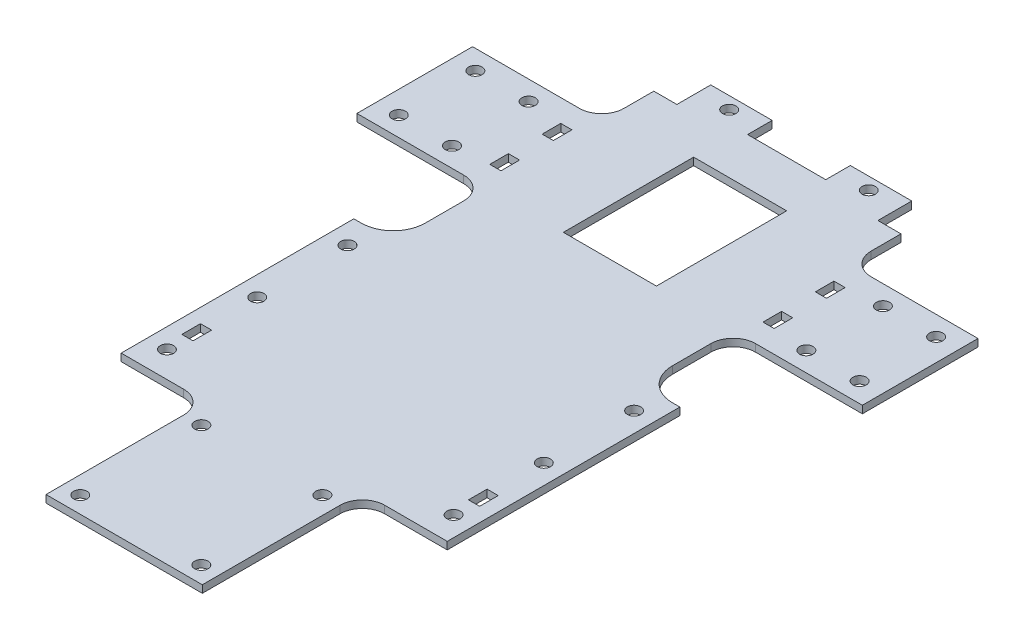
from build123d import *

# Parameters (mm, degrees)
SKETCH1_W            = 50
SKETCH1_H            = 9.1
BOSS_EXTRUDE1_DEPTH  = 2
SKETCH2_W            = 25
SKETCH2_H            = 6.6
CUT_EXTRUDE1_DEPTH   = 2
SKETCH3_R            = 1.8
CUT_EXTRUDE2_DEPTH   = 2
SKETCH4_W            = 66.4
SKETCH4_H            = 130
BOSS_EXTRUDE2_DEPTH  = 2
SKETCH5_W            = 66.4
SKETCH5_H            = 2
BOSS_EXTRUDE3_DEPTH  = 2.5
SKETCH6_W            = 8.6
SKETCH6_H            = 62.5
BOSS_EXTRUDE4_DEPTH  = 2
SKETCH7_R            = 1.8
SKETCH7_W            = 3
SKETCH7_H            = 5
CUT_EXTRUDE3_DEPTH   = 2
SKETCH8_W            = 25
SKETCH8_H            = 45
CUT_EXTRUDE4_DEPTH   = 20
SKETCH9_W            = 25
SKETCH9_H            = 10
BOSS_EXTRUDE5_DEPTH  = 2
SKETCH10_W           = 34.7
SKETCH10_H           = 27.07
BOSS_EXTRUDE6_DEPTH  = 2
SKETCH11_R           = 1.8
CUT_EXTRUDE5_DEPTH   = 2
SKETCH12_R           = 1.8
CUT_EXTRUDE6_DEPTH   = 2
SKETCH13_W           = 2
SKETCH13_H           = 2
BOSS_EXTRUDE7_DEPTH  = 44
SKETCH14_W           = 2
SKETCH14_H           = 2
BOSS_EXTRUDE8_DEPTH  = 46
BOSS_EXTRUDE9_DEPTH  = 2
SKETCH16_W           = 42
SKETCH16_H           = 43
BOSS_EXTRUDE10_DEPTH = 2
SKETCH18_R           = 1.8
CUT_EXTRUDE7_DEPTH   = 2
BOSS_EXTRUDE11_DEPTH = 2
BOSS_EXTRUDE12_DEPTH = 2
SKETCH21_W           = 2
SKETCH21_H           = 2
BOSS_EXTRUDE13_DEPTH = 10
SKETCH22_W           = 62.5
SKETCH22_H           = 2
BOSS_EXTRUDE14_DEPTH = 2
SKETCH23_W           = 62.5
SKETCH23_H           = 2
BOSS_EXTRUDE15_DEPTH = 2
SKETCH25_W           = 3
SKETCH25_H           = 5
CUT_EXTRUDE8_DEPTH   = 10


with BuildPart() as part:
    # Sketch1 → Boss-Extrude1 (new body)
    with BuildSketch(Plane(origin=(0, 0, 0), x_dir=(1, 0, 0), z_dir=(0, 1, 0))):
        with Locations((25, 4.55)):
            Rectangle(SKETCH1_W, SKETCH1_H)
    extrude(amount=BOSS_EXTRUDE1_DEPTH)

    # Sketch2 → Cut-Extrude1 (cut)
    with BuildSketch(Plane(origin=(0, 2, 0), x_dir=(1, 0, 0), z_dir=(0, 1, 0))):
        with Locations((25, 5.8)):
            Rectangle(SKETCH2_W, SKETCH2_H)
    extrude(amount=-CUT_EXTRUDE1_DEPTH, mode=Mode.SUBTRACT)

    # Sketch3 → Cut-Extrude2 (cut)
    with BuildSketch(Plane(origin=(0, 2, 0), x_dir=(1, 0, 0), z_dir=(0, 1, 0))):
        with Locations(Location((6.25, 5.8, 0), (0, 0, 270))):
            Circle(SKETCH3_R)
        with Locations(Location((43.75, 5.8, 0), (0, 0, 270))):
            Circle(SKETCH3_R)
    extrude(amount=-CUT_EXTRUDE2_DEPTH, mode=Mode.SUBTRACT)

    # Sketch4 → Boss-Extrude2 (add)
    with BuildSketch(Plane(origin=(0, 2, 0), x_dir=(1, 0, 0), z_dir=(0, 1, 0))):
        with Locations((25, -65)):
            Rectangle(SKETCH4_W, SKETCH4_H)
    extrude(amount=-BOSS_EXTRUDE2_DEPTH)

    # Sketch5 → Boss-Extrude3 (add)
    with BuildSketch(Plane.XY.offset(130)):
        with Locations((25, 1)):
            Rectangle(SKETCH5_W, SKETCH5_H)
    extrude(amount=BOSS_EXTRUDE3_DEPTH)

    # Sketch6 → Boss-Extrude4 (add)
    with BuildSketch(Plane(origin=(0, 2, 0), x_dir=(1, 0, 0), z_dir=(0, 1, 0))):
        with Locations((-12.5, -101.25)):
            Rectangle(SKETCH6_W, SKETCH6_H)
        with Locations((62.5, -101.25)):
            Rectangle(SKETCH6_W, SKETCH6_H)
    extrude(amount=-BOSS_EXTRUDE4_DEPTH)

    # Sketch7 → Cut-Extrude3 (cut)
    with BuildSketch(Plane(origin=(0, 2, 0), x_dir=(1, 0, 0), z_dir=(0, 1, 0))):
        with Locations(Location((-13.5, -77, 0), (0, 0, 270))):
            Circle(SKETCH7_R)
        with Locations(Location((-13.5, -101.25, 0), (0, 0, 270))):
            Circle(SKETCH7_R)
        with Locations(Location((-13.5, -125.5, 0), (0, 0, 270))):
            Circle(SKETCH7_R)
        with Locations(Location((63.5, -77, 0), (0, 0, 270))):
            Circle(SKETCH7_R)
        with Locations(Location((63.5, -101.25, 0), (0, 0, 270))):
            Circle(SKETCH7_R)
        with Locations(Location((63.5, -125.5, 0), (0, 0, 270))):
            Circle(SKETCH7_R)
        with Locations((-13.5, -117.5)):
            Rectangle(SKETCH7_W, SKETCH7_H)
        with Locations((63.5, -117.5)):
            Rectangle(SKETCH7_W, SKETCH7_H)
    extrude(amount=-CUT_EXTRUDE3_DEPTH, mode=Mode.SUBTRACT)

    # Sketch8 → Cut-Extrude4 (cut)
    with BuildSketch(Plane(origin=(0, 2, 0), x_dir=(1, 0, 0), z_dir=(0, 1, 0))):
        with Locations((25, -22.5)):
            Rectangle(SKETCH8_W, SKETCH8_H)
    extrude(amount=-CUT_EXTRUDE4_DEPTH, mode=Mode.SUBTRACT)

    # Sketch9 → Boss-Extrude5 (add)
    with BuildSketch(Plane(origin=(0, 2, 0), x_dir=(1, 0, 0), z_dir=(0, 1, 0))):
        with Locations((25, -5)):
            Rectangle(SKETCH9_W, SKETCH9_H)
    extrude(amount=-BOSS_EXTRUDE5_DEPTH)

    # Sketch10 → Boss-Extrude6 (add)
    with BuildSketch(Plane(origin=(0, 2, 0), x_dir=(1, 0, 0), z_dir=(0, 1, 0))):
        with Locations((-25.55, -29.535)):
            Rectangle(SKETCH10_W, SKETCH10_H)
        with Locations((75.55, -29.535)):
            Rectangle(SKETCH10_W, SKETCH10_H)
    extrude(amount=-BOSS_EXTRUDE6_DEPTH)

    # Sketch11 → Cut-Extrude5 (cut)
    with BuildSketch(Plane(origin=(0, 2, 0), x_dir=(1, 0, 0), z_dir=(0, 1, 0))):
        with Locations(Location((-36.9, -19.25, 0), (0, 0, 270))):
            Circle(SKETCH11_R)
        with Locations(Location((-36.9, -39.82, 0), (0, 0, 270))):
            Circle(SKETCH11_R)
        with Locations(Location((-22.6, -19.25, 0), (0, 0, 270))):
            Circle(SKETCH11_R)
        with Locations(Location((-22.6, -39.82, 0), (0, 0, 270))):
            Circle(SKETCH11_R)
    extrude(amount=-CUT_EXTRUDE5_DEPTH, mode=Mode.SUBTRACT)

    # Sketch12 → Cut-Extrude6 (cut)
    with BuildSketch(Plane(origin=(0, 2, 0), x_dir=(1, 0, 0), z_dir=(0, 1, 0))):
        with Locations(Location((72.6, -19.25, 0), (0, 0, 270))):
            Circle(SKETCH12_R)
        with Locations(Location((86.9, -19.25, 0), (0, 0, 270))):
            Circle(SKETCH12_R)
        with Locations(Location((72.6, -39.82, 0), (0, 0, 270))):
            Circle(SKETCH12_R)
        with Locations(Location((86.9, -39.82, 0), (0, 0, 270))):
            Circle(SKETCH12_R)
    extrude(amount=-CUT_EXTRUDE6_DEPTH, mode=Mode.SUBTRACT)

    # Sketch13 → Boss-Extrude7 (add)
    with BuildSketch(Plane.ZY.offset(42.9)):
        with Locations((15, 1)):
            Rectangle(SKETCH13_W, SKETCH13_H)
        with Locations((44.07, 1)):
            Rectangle(SKETCH13_W, SKETCH13_H)
    extrude(amount=-BOSS_EXTRUDE7_DEPTH)

    # Sketch14 → Boss-Extrude8 (add)
    with BuildSketch(Plane(origin=(92.9, 0, 0), x_dir=(0, 0, -1), z_dir=(1, 0, 0))):
        with Locations((-15, 1)):
            Rectangle(SKETCH14_W, SKETCH14_H)
        with Locations((-44.07, 1)):
            Rectangle(SKETCH14_W, SKETCH14_H)
    extrude(amount=-BOSS_EXTRUDE8_DEPTH)

    # Sketch15 → Boss-Extrude9 (add)
    with BuildSketch(Plane(origin=(0, 2, 0), x_dir=(1, 0, 0), z_dir=(0, 1, 0))):
        with BuildLine():
            Line((-8.2, -14), (-8.2, -8))
            ThreePointArc((-8.2, -8), (-9.957359313, -12.242640687), (-14.2, -14))
            Line((-14.2, -14), (-8.2, -14))
        make_face()
        with BuildLine():
            Line((-14.2, -45.07), (-8.2, -45.07))
            Line((-8.2, -45.07), (-8.2, -51.07))
            ThreePointArc((-8.2, -51.07), (-9.957359313, -46.827359313), (-14.2, -45.07))
        make_face()
        with BuildLine():
            ThreePointArc((64.2, -45.07), (59.957359313, -46.827359313), (58.2, -51.07))
            Line((58.2, -51.07), (58.2, -45.07))
            Line((58.2, -45.07), (64.2, -45.07))
        make_face()
        with BuildLine():
            ThreePointArc((58.2, -8), (59.957359313, -12.242640687), (64.2, -14))
            Line((64.2, -14), (58.2, -14))
            Line((58.2, -14), (58.2, -8))
        make_face()
    extrude(amount=-BOSS_EXTRUDE9_DEPTH)

    # Sketch16 → Boss-Extrude10 (add)
    with BuildSketch(Plane(origin=(0, 2, 0), x_dir=(1, 0, 0), z_dir=(0, 1, 0))):
        with Locations((25, -154)):
            Rectangle(SKETCH16_W, SKETCH16_H)
    extrude(amount=-BOSS_EXTRUDE10_DEPTH)

    # Sketch18 → Cut-Extrude7 (cut)
    with BuildSketch(Plane(origin=(0, 2, 0), x_dir=(1, 0, 0), z_dir=(0, 1, 0))):
        with Locations(Location((8.74, -171.03, 0), (0, 0, 270))):
            Circle(SKETCH18_R)
        with Locations(Location((41.26, -171.03, 0), (0, 0, 270))):
            Circle(SKETCH18_R)
        with Locations(Location((8.74, -138.5, 0), (0, 0, 270))):
            Circle(SKETCH18_R)
        with Locations(Location((41.26, -138.5, 0), (0, 0, 270))):
            Circle(SKETCH18_R)
    extrude(amount=-CUT_EXTRUDE7_DEPTH, mode=Mode.SUBTRACT)

    # Sketch19 → Boss-Extrude11 (add)
    with BuildSketch(Plane(origin=(0, 2, 0), x_dir=(1, 0, 0), z_dir=(0, 1, 0))):
        with BuildLine():
            ThreePointArc((-16.8, -70), (-10.718881682, -67.481118318), (-8.2, -61.4))
            Line((-8.2, -61.4), (-8.2, -70))
            Line((-8.2, -70), (-16.8, -70))
        make_face()
        with BuildLine():
            ThreePointArc((58.2, -61.4), (60.718881682, -67.481118318), (66.8, -70))
            Line((66.8, -70), (58.2, -70))
            Line((58.2, -70), (58.2, -61.4))
        make_face()
    extrude(amount=-BOSS_EXTRUDE11_DEPTH)

    # Sketch20 → Boss-Extrude12 (add)
    with BuildSketch(Plane(origin=(0, 2, 0), x_dir=(1, 0, 0), z_dir=(0, 1, 0))):
        with BuildLine():
            Line((-2, -132.5), (4, -132.5))
            Line((4, -132.5), (4, -138.5))
            ThreePointArc((4, -138.5), (2.242640687, -134.257359313), (-2, -132.5))
        make_face()
        with BuildLine():
            ThreePointArc((52, -132.5), (47.757359313, -134.257359313), (46, -138.5))
            Line((46, -138.5), (46, -132.5))
            Line((46, -132.5), (52, -132.5))
        make_face()
    extrude(amount=-BOSS_EXTRUDE12_DEPTH)

    # Sketch21 → Boss-Extrude13 (add)
    with BuildSketch(Plane(origin=(0, 0, -9.1), x_dir=(-1, 0, 0), z_dir=(0, 0, -1))):
        with Locations((-51, 1)):
            Rectangle(SKETCH21_W, SKETCH21_H)
        with Locations((-36.5, 1)):
            Rectangle(SKETCH21_W, SKETCH21_H)
        with Locations((-13.5, 1)):
            Rectangle(SKETCH21_W, SKETCH21_H)
        with Locations((1, 1)):
            Rectangle(SKETCH21_W, SKETCH21_H)
    extrude(amount=-BOSS_EXTRUDE13_DEPTH)

    # Sketch22 → Boss-Extrude14 (add)
    with BuildSketch(Plane.ZY.offset(16.8)):
        with Locations((101.25, 1)):
            Rectangle(SKETCH22_W, SKETCH22_H)
    extrude(amount=BOSS_EXTRUDE14_DEPTH)

    # Sketch23 → Boss-Extrude15 (add)
    with BuildSketch(Plane(origin=(66.8, 0, 0), x_dir=(0, 0, -1), z_dir=(1, 0, 0))):
        with Locations((-101.25, 1)):
            Rectangle(SKETCH23_W, SKETCH23_H)
    extrude(amount=BOSS_EXTRUDE15_DEPTH)

    # Sketch25 → Cut-Extrude8 (cut)
    with BuildSketch(Plane(origin=(0, 2, 0), x_dir=(1, 0, 0), z_dir=(0, 1, 0))):
        with Locations((-11.7, -22.5)):
            Rectangle(SKETCH25_W, SKETCH25_H)
        with Locations((-11.7, -36.57)):
            Rectangle(SKETCH25_W, SKETCH25_H)
        with Locations((61.7, -22.5)):
            Rectangle(SKETCH25_W, SKETCH25_H)
        with Locations((61.7, -36.57)):
            Rectangle(SKETCH25_W, SKETCH25_H)
    extrude(amount=-CUT_EXTRUDE8_DEPTH, mode=Mode.SUBTRACT)


solid = part.part
